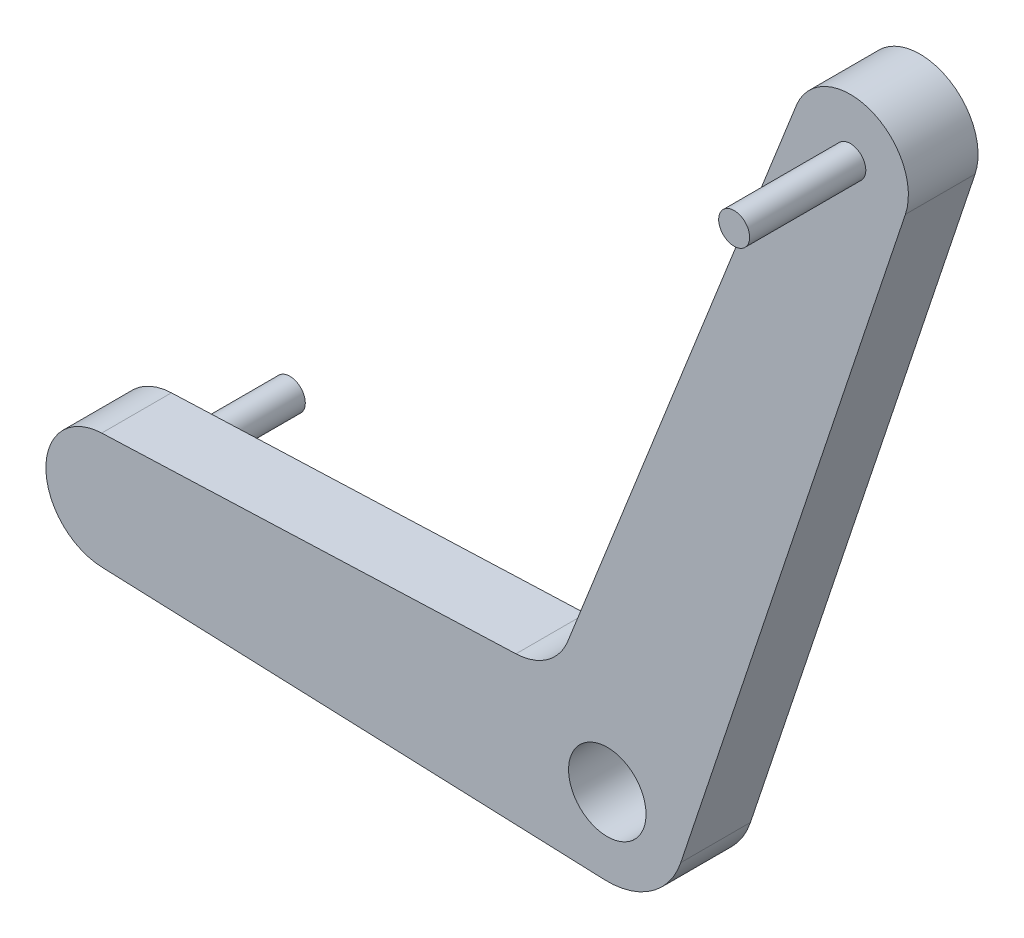
from build123d import *

# Parameters (mm, degrees)
EXTRUDE_1_DEPTH     = 18
SKETCH_2_R          = 10
CUT_EXTRUDE_1_DEPTH = 18
SKETCH_3_R          = 4
EXTRUDE_2_DEPTH     = 30
SKETCH_4_R          = 4
EXTRUDE_3_DEPTH     = 30


with BuildPart() as part:
    # 草图1 → 凸台-拉伸1 (new body)
    with BuildSketch(Plane.XY):
        with BuildLine():
            Line((-0.769230769, -19.985201626), (-130.576923077, -14.988901219))
            ThreePointArc((-130.576923077, -14.988901219), (-145, 0), (-130.576923077, 14.988901219))
            Line((-130.576923077, 14.988901219), (-23.583519409, 19.107079247))
            ThreePointArc((-23.583519409, 19.107079247), (-15.488001892, 21.85715805), (-10.210076964, 28.583512616))
            Line((-10.210076964, 28.583512616), (48.810330778, 177.946063765))
            ThreePointArc((48.810330778, 177.946063765), (67.89099845, 186.528985226), (76.990642321, 167.689269171))
            Line((76.990642321, 167.689269171), (18.973261361, -6.325768991))
            ThreePointArc((18.973261361, -6.325768991), (11.379442316, -16.447136303), (-0.769230769, -19.985201626))
        make_face()
    extrude(amount=EXTRUDE_1_DEPTH)

    # 草图2 → 切除-拉伸1 (cut)
    with BuildSketch(Plane.XY):
        Circle(SKETCH_2_R)
    extrude(amount=CUT_EXTRUDE_1_DEPTH, mode=Mode.SUBTRACT)

    # 草图3 → 凸台-拉伸2 (add)
    with BuildSketch(Plane.XY):
        with Locations((-130, 0)):
            Circle(SKETCH_3_R)
    extrude(amount=-EXTRUDE_2_DEPTH)

    # 草图4 → 凸台-拉伸3 (add)
    with BuildSketch(Plane.XY.offset(18)):
        with Locations(Location((62.7606963, 172.433595914, 0), (0, 0, 180))):
            Circle(SKETCH_4_R)
    extrude(amount=EXTRUDE_3_DEPTH)


solid = part.part
